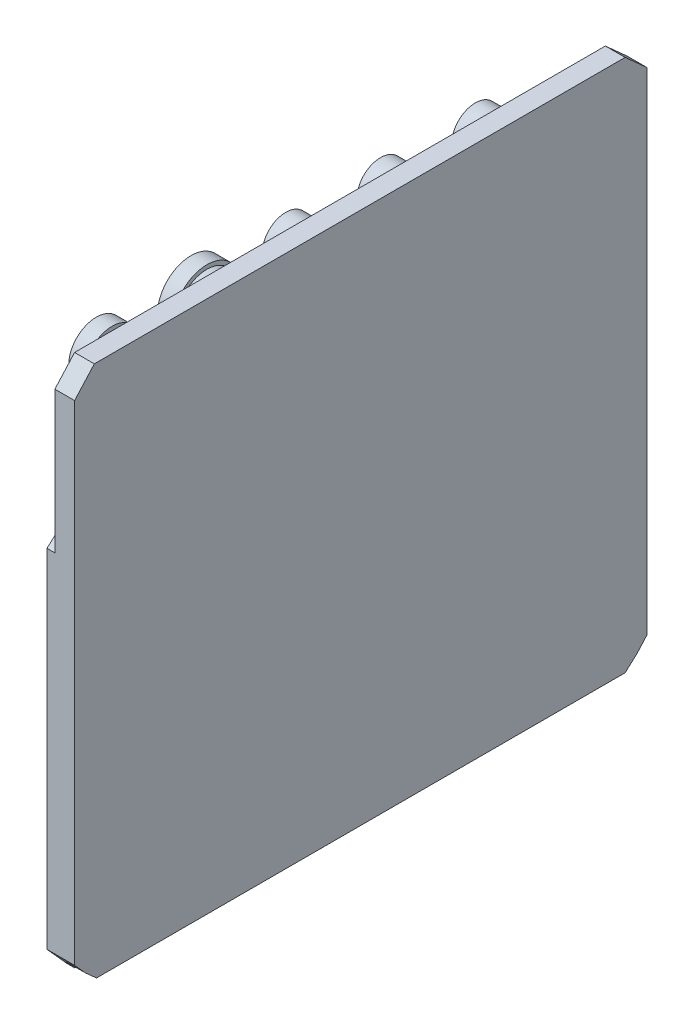
from build123d import *
from OCP.BRepFilletAPI import BRepFilletAPI_MakeChamfer

# Parameters (mm, degrees)
SKETCH_1_W      = 145
SKETCH_1_H      = 135
EXTRUDE_1_DEPTH = 5
CHAMFER_1_SIZE  = 5
CHAMFER_1_SIZE2 = 5.553062574
SKETCH_2_W      = 145
SKETCH_2_H      = 98.542875089
EXTRUDE_2_DEPTH = 2
CHAMFER_2_SIZE  = 5
CHAMFER_2_SIZE2 = 5.553062574
SKETCH_3_R      = 5
SKETCH_3_R_2    = 7.5
SKETCH_3_R_3    = 6
EXTRUDE_3_DEPTH = 10
SKETCH_7_R      = 6
SKETCH_7_R_2    = 4
SKETCH_7_R_3    = 8.5
SKETCH_7_R_4    = 6.5
SKETCH_7_R_5    = 7
EXTRUDE_6_DEPTH = 4


with BuildPart() as part:
    # ｽｹｯﾁ1 → 押し出し1 (new body)
    with BuildSketch(Plane(origin=(0, 0, 0), x_dir=(0, 0, -1), z_dir=(1, 0, 0))):
        with Locations((72.5, 67.5)):
            Rectangle(SKETCH_1_W, SKETCH_1_H)
    extrude(amount=EXTRUDE_1_DEPTH)

    # 面取り1: one chamfer whose edges measure the first distance from different faces: ONE call of the kernel's chamfer builder (chamfer() names one face for all edges)
    chamfer_1_edges_1 = [part.edges().sort_by_distance(p)[0] for p in [
        (2.5, 135, 0),
    ]]
    chamfer_1_side_1 = [part.faces().sort_by_distance(p)[0] for p in [
        (2.5, 135, -72.5),
    ]]
    chamfer_1_edges_2 = [part.edges().sort_by_distance(p)[0] for p in [
        (2.5, 135, -145),
    ]]
    chamfer_1_side_2 = [part.faces().sort_by_distance(p)[0] for p in [
        (2.5, 67.5, -145),
    ]]
    chamfer_1_edges_3 = [part.edges().sort_by_distance(p)[0] for p in [
        (2.5, 0, -145),
    ]]
    chamfer_1_side_3 = [part.faces().sort_by_distance(p)[0] for p in [
        (2.5, 0, -72.5),
    ]]
    chamfer_1_edges_4 = [part.edges().sort_by_distance(p)[0] for p in [
        (2.5, 0, 0),
    ]]
    chamfer_1_side_4 = [part.faces().sort_by_distance(p)[0] for p in [
        (2.5, 67.5, 0),
    ]]
    chamfer_1 = BRepFilletAPI_MakeChamfer(part.part.solid().wrapped)
    for e in chamfer_1_edges_1:
        chamfer_1.Add(CHAMFER_1_SIZE, CHAMFER_1_SIZE2, e.wrapped, chamfer_1_side_1[0].wrapped)  # the first distance lies on this face
    for e in chamfer_1_edges_2:
        chamfer_1.Add(CHAMFER_1_SIZE, CHAMFER_1_SIZE2, e.wrapped, chamfer_1_side_2[0].wrapped)  # the first distance lies on this face
    for e in chamfer_1_edges_3:
        chamfer_1.Add(CHAMFER_1_SIZE, CHAMFER_1_SIZE2, e.wrapped, chamfer_1_side_3[0].wrapped)  # the first distance lies on this face
    for e in chamfer_1_edges_4:
        chamfer_1.Add(CHAMFER_1_SIZE, CHAMFER_1_SIZE2, e.wrapped, chamfer_1_side_4[0].wrapped)  # the first distance lies on this face
    add(Compound.cast(chamfer_1.Shape()), mode=Mode.REPLACE)

    # ｽｹｯﾁ2 → 押し出し2 (add)
    with BuildSketch(Plane.ZY):
        with Locations((-72.5, 49.271437545)):
            Rectangle(SKETCH_2_W, SKETCH_2_H)
    extrude(amount=EXTRUDE_2_DEPTH)

    # 面取り2: one chamfer whose edges measure the first distance from different faces: ONE call of the kernel's chamfer builder (chamfer() names one face for all edges)
    chamfer_2_edges_1 = [part.edges().sort_by_distance(p)[0] for p in [
        (-1, 0, -145),
    ]]
    chamfer_2_side_1 = [part.faces().sort_by_distance(p)[0] for p in [
        (1.658082608, 63.325171213, -145),
    ]]
    chamfer_2_edges_2 = [part.edges().sort_by_distance(p)[0] for p in [
        (-1, 0, 0),
    ]]
    chamfer_2_side_2 = [part.faces().sort_by_distance(p)[0] for p in [
        (1.44516378, 0, -72.693189796),
    ]]
    chamfer_2_edges_3 = [part.edges().sort_by_distance(p)[0] for p in [
        (-1, 98.542875089, 0),
    ]]
    chamfer_2_side_3 = [part.faces().sort_by_distance(p)[0] for p in [
        (1.658082608, 62.905146639, 0),
    ]]
    chamfer_2_edges_4 = [part.edges().sort_by_distance(p)[0] for p in [
        (-1, 98.542875089, -145),
    ]]
    chamfer_2_side_4 = [part.faces().sort_by_distance(p)[0] for p in [
        (-1, 98.542875089, -72.5),
    ]]
    chamfer_2 = BRepFilletAPI_MakeChamfer(part.part.solid().wrapped)
    for e in chamfer_2_edges_1:
        chamfer_2.Add(CHAMFER_2_SIZE, CHAMFER_2_SIZE2, e.wrapped, chamfer_2_side_1[0].wrapped)  # the first distance lies on this face
    for e in chamfer_2_edges_2:
        chamfer_2.Add(CHAMFER_2_SIZE, CHAMFER_2_SIZE2, e.wrapped, chamfer_2_side_2[0].wrapped)  # the first distance lies on this face
    for e in chamfer_2_edges_3:
        chamfer_2.Add(CHAMFER_2_SIZE, CHAMFER_2_SIZE2, e.wrapped, chamfer_2_side_3[0].wrapped)  # the first distance lies on this face
    for e in chamfer_2_edges_4:
        chamfer_2.Add(CHAMFER_2_SIZE, CHAMFER_2_SIZE2, e.wrapped, chamfer_2_side_4[0].wrapped)  # the first distance lies on this face
    add(Compound.cast(chamfer_2.Shape()), mode=Mode.REPLACE)

    # ｽｹｯﾁ3 → 押し出し3 (add)
    with BuildSketch(Plane.ZY):
        with Locations((-120.5, 119)):
            Circle(SKETCH_3_R)
        with Locations((-96.5, 119.003353079)):
            Circle(SKETCH_3_R)
        with Locations((-72.5, 119)):
            Circle(SKETCH_3_R)
        with Locations((-48.5, 119)):
            Circle(SKETCH_3_R_2)
        with Locations((-24.5, 119.003353079)):
            Circle(SKETCH_3_R_3)
    extrude(amount=EXTRUDE_3_DEPTH)

    # ｽｹｯﾁ7 → 押し出し6 (add)
    # profile 1 of 5: a face of its own
    with BuildSketch(Plane.ZY.offset(10)):
        with Locations((-120.5, 119)):
            Circle(SKETCH_7_R)
        with Locations((-120.5, 119)):
            Circle(SKETCH_7_R_2, mode=Mode.SUBTRACT)
    # profile 2 of 5: a face of its own
    with BuildSketch(Plane.ZY.offset(10)):
        with Locations((-96.5, 119.003353079)):
            Circle(SKETCH_7_R)
        with Locations((-96.5, 119.003353079)):
            Circle(SKETCH_7_R_2, mode=Mode.SUBTRACT)
    # profile 3 of 5: a face of its own
    with BuildSketch(Plane.ZY.offset(10)):
        with Locations((-72.5, 119)):
            Circle(SKETCH_7_R)
        with Locations((-72.5, 119)):
            Circle(SKETCH_7_R_2, mode=Mode.SUBTRACT)
    # profile 4 of 5: a face of its own
    with BuildSketch(Plane.ZY.offset(10)):
        with Locations((-48.5, 119)):
            Circle(SKETCH_7_R_3)
        with Locations((-48.5, 119)):
            Circle(SKETCH_7_R_4, mode=Mode.SUBTRACT)
    # profile 5 of 5: a face of its own
    with BuildSketch(Plane.ZY.offset(10)):
        with Locations((-24.5, 119.003353079)):
            Circle(SKETCH_7_R_5)
        with Locations((-24.5, 119.003353079)):
            Circle(SKETCH_7_R_2, mode=Mode.SUBTRACT)
    extrude(amount=EXTRUDE_6_DEPTH)


solid = part.part
